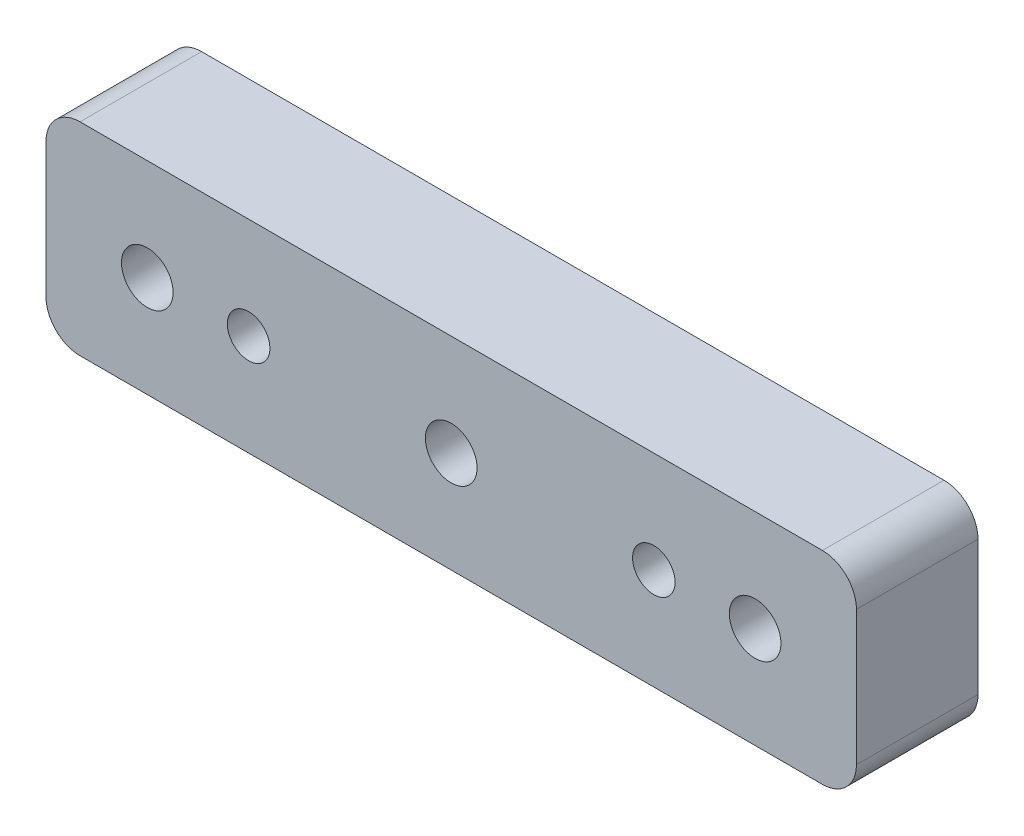
from build123d import *

# Parameters (mm, degrees)
BOSS_EXTRUDE1_DEPTH   = 12
SKETCH3_R             = 2.55
CUT_EXTRUDE2_DEPTH    = 43.941821107
M5X0_8_TAPPED_HOLE1_D = 4.2


with BuildPart() as part:
    # Sketch1 → Boss-Extrude1 (new body)
    with BuildSketch(Plane.XY):
        with BuildLine():
            Line((36.64, -10), (-36.64, -10))
            ThreePointArc((-36.64, -10), (-39.015878785, -9.015878785), (-40, -6.64))
            Line((-40, -6.64), (-40, 6.64))
            ThreePointArc((-40, 6.64), (-39.015878785, 9.015878785), (-36.64, 10))
            Line((-36.64, 10), (36.64, 10))
            ThreePointArc((36.64, 10), (39.015878785, 9.015878785), (40, 6.64))
            Line((40, 6.64), (40, -6.64))
            ThreePointArc((40, -6.64), (39.015878785, -9.015878785), (36.64, -10))
        make_face()
    extrude(amount=BOSS_EXTRUDE1_DEPTH)

    # Sketch3 → Cut-Extrude2 (cut, through all)
    with BuildSketch(Plane.XY.offset(12)):
        with Locations((-30, 0)):
            Circle(SKETCH3_R)
        with Locations(Location((30, 0, 0), (0, 0, 180))):
            Circle(SKETCH3_R)
        Circle(SKETCH3_R)
    extrude(amount=-CUT_EXTRUDE2_DEPTH, mode=Mode.SUBTRACT)

    # M5x0.8 Tapped Hole1 (through all)
    with Locations(Plane.XY.offset(12)):
        with Locations((-20, 0), (20, 0)):
            Hole(M5X0_8_TAPPED_HOLE1_D / 2)


solid = part.part
